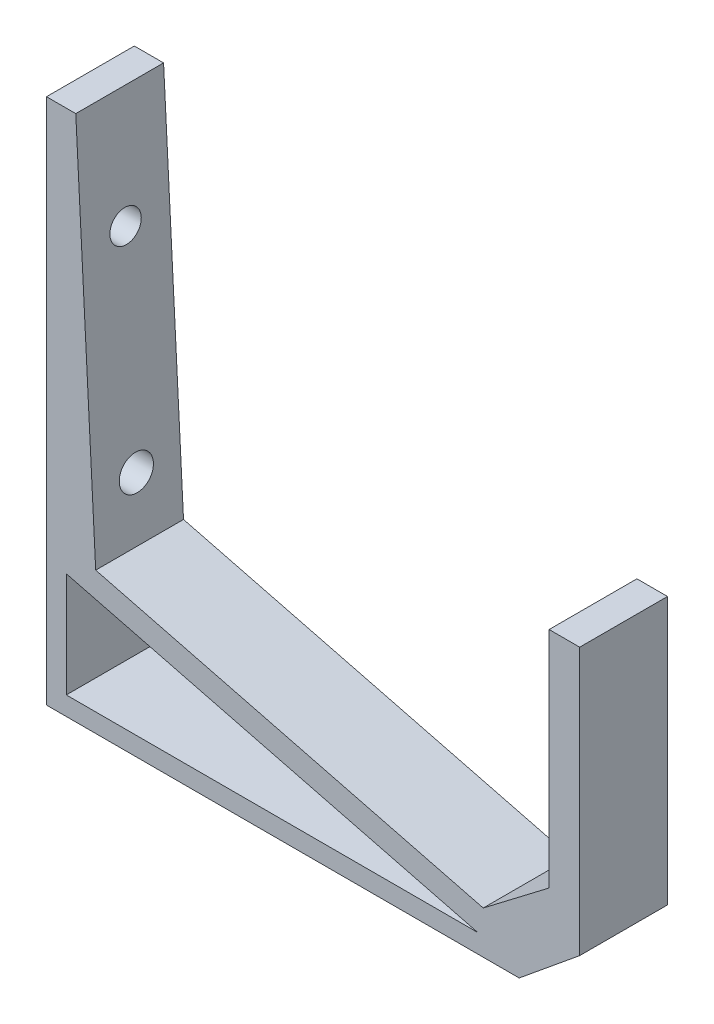
from build123d import *

# Parameters (mm, degrees)
BOSS_EXTRU_1_DEPTH      = 30
ENL_V_MAT_EXTRU_1_REACH = 247.316
ESQUISSE3_R             = 5.832843768
ESQUISSE3_R_2           = 5.351266955
ENL_V_MAT_EXTRU_2_DEPTH = 236.071663242


with BuildPart() as part:
    # Esquisse1 → Boss.-Extru.1 (new body)
    with BuildSketch(Plane.XY):
        Polygon((-14.050192106, 18.448375062), (-4.050192106, 18.448375062), (2.761752479, -113.222934174), (135.150414635, -146.982486488), (157.659448917, -129.804321414), (157.659448917, -53.333080108), (168.106392916, -53.333080108), (168.106392916, -144.596025192), (147.431500323, -161.551624938), (-14.050192106, -161.551624938), align=None)
    extrude(amount=BOSS_EXTRU_1_DEPTH)

    # Enlèv. mat.-Extru.1: up to this plane
    enl_v_mat_extru_1_end = Plane(origin=(-4.050192106, 18.448375062, 30), z_dir=(-0.9986644529274081, -0.05166537001900487, 0))
    # Esquisse3 → Enlèv. mat.-Extru.1 (cut, up to the surface)
    with BuildSketch(Plane.ZY.offset(14.050192106), mode=Mode.PRIVATE) as enl_v_mat_extru_1_sk1:
        with Locations((15.037241333, -92.337647956)):
            Circle(ESQUISSE3_R)
    enl_v_mat_extru_1_tool1 = split(extrude(enl_v_mat_extru_1_sk1.sketch, amount=-ENL_V_MAT_EXTRU_1_REACH, mode=Mode.PRIVATE), bisect_by=enl_v_mat_extru_1_end, keep=Keep.BOTH, mode=Mode.PRIVATE)
    add(enl_v_mat_extru_1_tool1.solids().sort_by_distance((-14.050192, -92.337648, 15.037241))[0], mode=Mode.SUBTRACT)
    # Esquisse3 → Enlèv. mat.-Extru.1 (cut, up to the surface)
    with BuildSketch(Plane.ZY.offset(14.050192106), mode=Mode.PRIVATE) as enl_v_mat_extru_1_sk2:
        with Locations((15.037241333, -21.264425603)):
            Circle(ESQUISSE3_R_2)
    enl_v_mat_extru_1_tool2 = split(extrude(enl_v_mat_extru_1_sk2.sketch, amount=-ENL_V_MAT_EXTRU_1_REACH, mode=Mode.PRIVATE), bisect_by=enl_v_mat_extru_1_end, keep=Keep.BOTH, mode=Mode.PRIVATE)
    add(enl_v_mat_extru_1_tool2.solids().sort_by_distance((-14.050192, -21.264426, 15.037241))[0], mode=Mode.SUBTRACT)

    # Esquisse5 → Enlèv. mat.-Extru.2 (cut, through all)
    with BuildSketch(Plane.XY.offset(30)):
        Polygon((-7.286706934, -119.304572357), (133.336369925, -155.163928004), (-7.286706934, -155.163928004), align=None)
    extrude(amount=-ENL_V_MAT_EXTRU_2_DEPTH, mode=Mode.SUBTRACT)


solid = part.part
